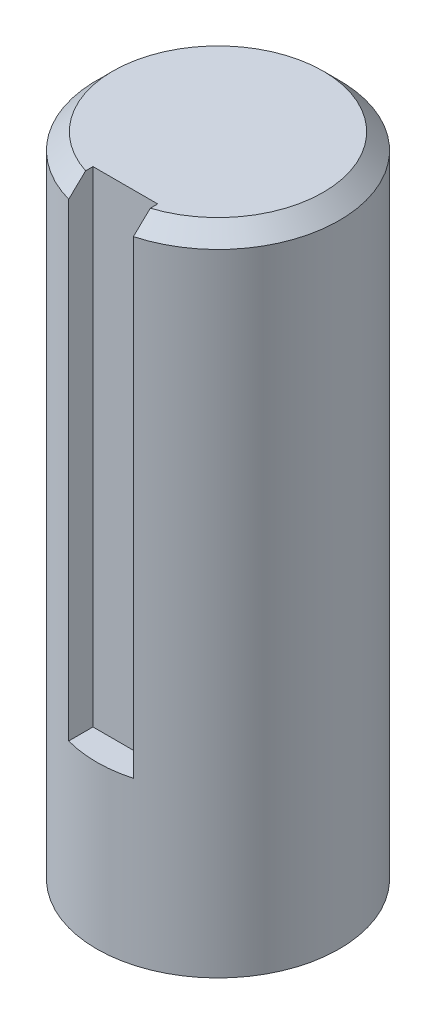
from build123d import *

# Parameters (mm, degrees)
SKETCH1_R           = 15
BOSS_EXTRUDE1_DEPTH = 80
CHAMFER1_SIZE       = 2
CUT_EXTRUDE1_START  = -60
CUT_EXTRUDE1_DEPTH  = 60


with BuildPart() as part:
    # Sketch1 → Boss-Extrude1 (new body)
    with BuildSketch(Plane(origin=(0, 0, 0), x_dir=(-1, 0, 0), z_dir=(0, 1, 0))):
        with Locations(Location((0, 0, 0), (0, 0, 90))):
            Circle(SKETCH1_R)
    extrude(amount=BOSS_EXTRUDE1_DEPTH)

    # Chamfer1
    chamfer1_edges = [part.edges().sort_by_distance(p)[0] for p in [
        (0, 80, -15),
    ]]
    chamfer(chamfer1_edges, length=CHAMFER1_SIZE)

    # Sketch3 → Cut-Extrude1 (cut)
    with BuildSketch(Plane(origin=(0, 80, 0), x_dir=(-1, 0, 0), z_dir=(0, 1, 0)).offset(CUT_EXTRUDE1_START)):
        with BuildLine():
            Line((-4, 14.456832295), (-4, 11.456832295))
            Line((-4, 11.456832295), (4, 11.456832295))
            Line((4, 11.456832295), (4, 14.456832295))
            ThreePointArc((4, 14.456832295), (0, 15), (-4, 14.456832295))
        make_face()
    extrude(amount=CUT_EXTRUDE1_DEPTH, mode=Mode.SUBTRACT)


solid = part.part
